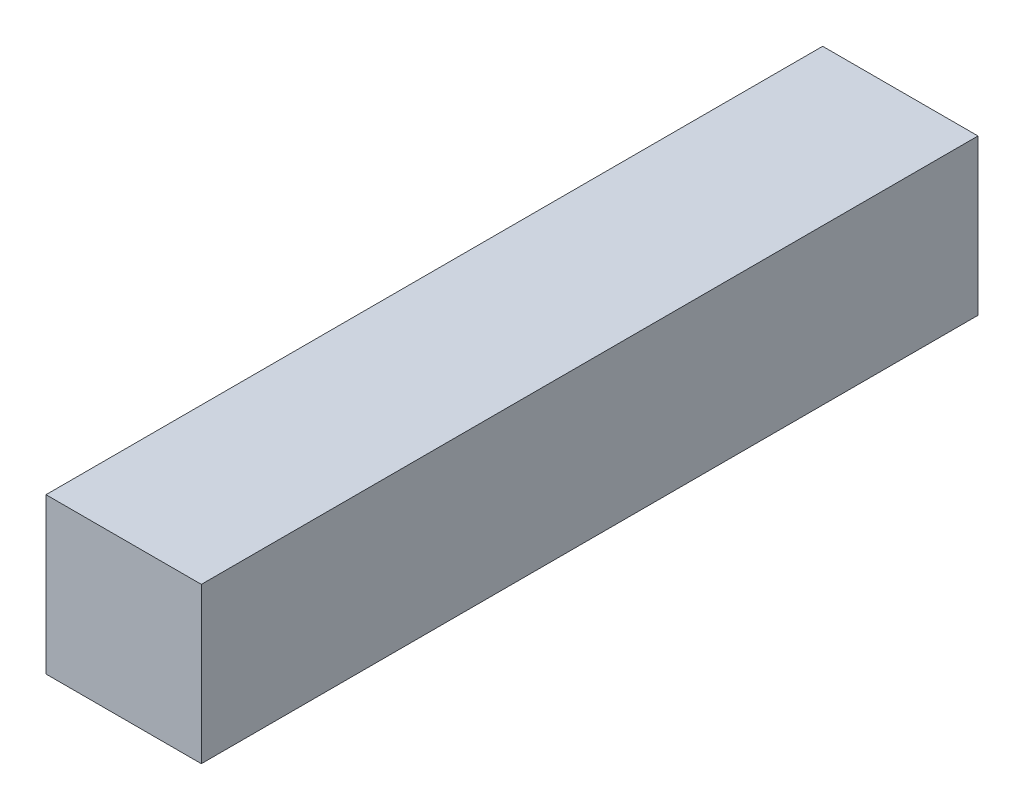
from build123d import *

# Parameters (mm, degrees)
SKETCH3_W           = 100
SKETCH3_H           = 100
BOSS_EXTRUDE1_DEPTH = 500


with BuildPart() as part:
    # Sketch3 → Boss-Extrude1 (new body)
    with BuildSketch(Plane.XY):
        Rectangle(SKETCH3_W, SKETCH3_H)
    extrude(amount=BOSS_EXTRUDE1_DEPTH)


solid = part.part
